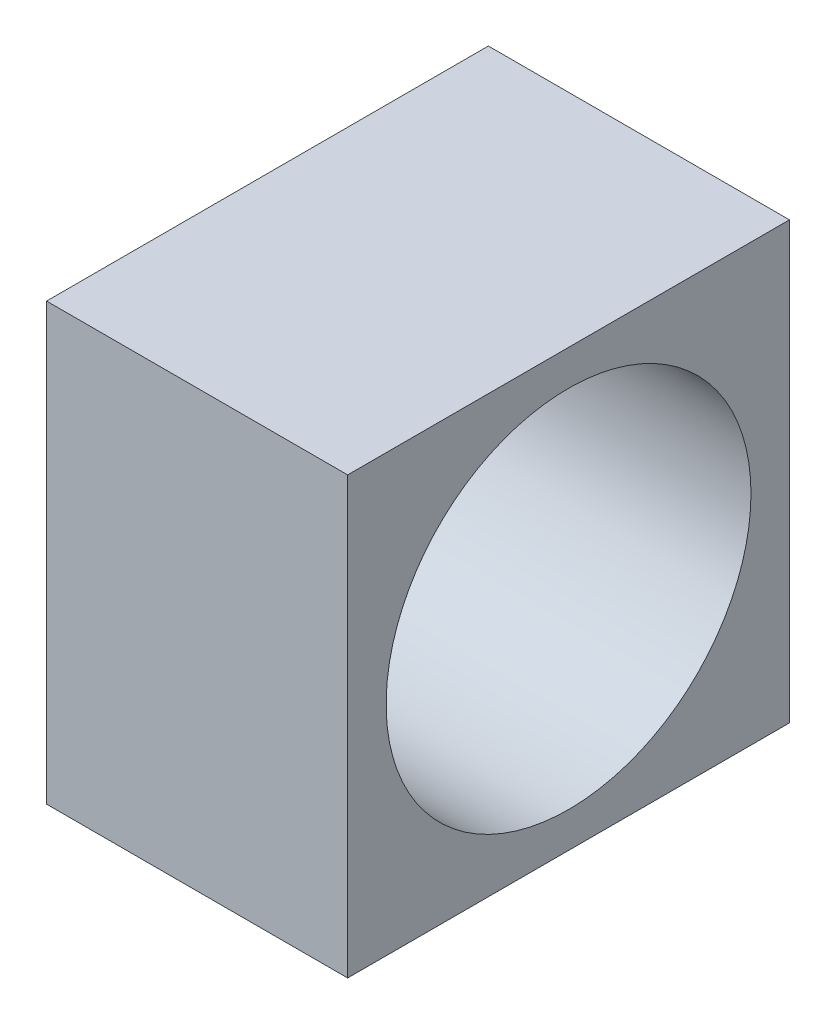
from build123d import *

# Parameters (mm, degrees)
SKETCH1_W           = 12.471775368
SKETCH1_H           = 12.3
SKETCH1_R           = 5.15
BOSS_EXTRUDE1_DEPTH = 8.5


with BuildPart() as part:
    # Sketch1 → Boss-Extrude1 (new body)
    with BuildSketch(Plane(origin=(0, 0, 0), x_dir=(0, 0, -1), z_dir=(1, 0, 0))):
        Rectangle(SKETCH1_W, SKETCH1_H)
        Circle(SKETCH1_R, mode=Mode.SUBTRACT)
    extrude(amount=BOSS_EXTRUDE1_DEPTH)


solid = part.part
